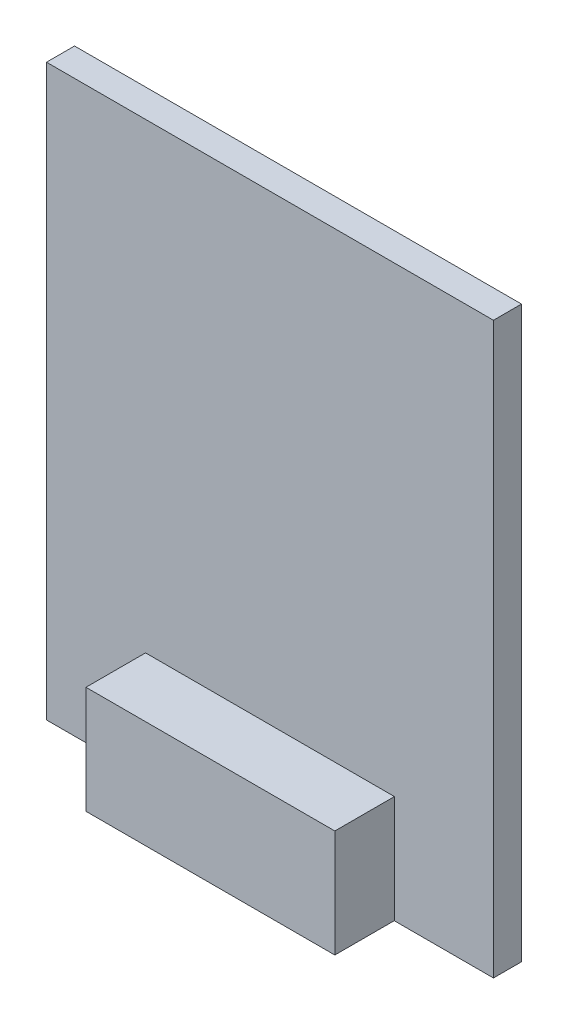
from build123d import *

# Parameters (mm, degrees)
SKETCH_1_W      = 25.5
SKETCH_1_H      = 32.5
EXTRUDE_1_DEPTH = 1.6
SKETCH_2_W      = 14.2
SKETCH_2_H      = 6.13
EXTRUDE_3_DEPTH = 5


with BuildPart() as part:
    # 草图1 → 凸台-拉伸1 (new body)
    with BuildSketch(Plane.XY):
        Rectangle(SKETCH_1_W, SKETCH_1_H)
    extrude(amount=EXTRUDE_1_DEPTH)

    # 草图2 → 凸台-拉伸3 (add)
    with BuildSketch(Plane.XY):
        with Locations((0, -13.175)):
            Rectangle(SKETCH_2_W, SKETCH_2_H)
    extrude(amount=EXTRUDE_3_DEPTH)


solid = part.part
